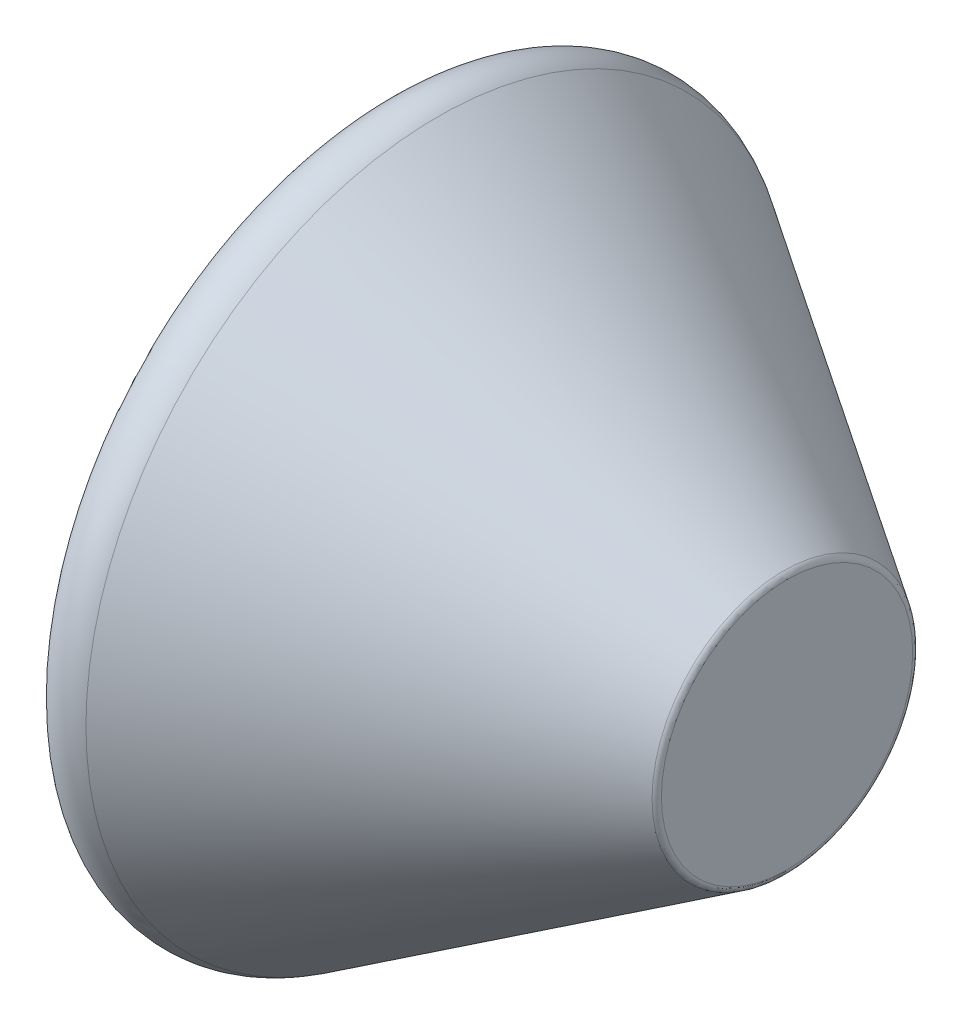
from build123d import *


with BuildPart() as part:
    # Sketch1 → Revolve1 (revolve)
    with BuildSketch(Plane.XY, mode=Mode.PRIVATE) as revolve1_sk:
        with BuildLine():
            Line((-710, 0), (2575, 0))
            Line((2575, 0), (2575, 878.535400948))
            ThreePointArc((2575, 878.535400948), (2568.836337785, 902.584839394), (2551.864980417, 920.704973239))
            Line((2551.864980417, 920.704973239), (134.324902087, 2460.847861453))
            ThreePointArc((134.324902087, 2460.847861453), (-73.907940114, 2488.825493589), (-229.939705353, 2348.121006428))
            ThreePointArc((-229.939705353, 2348.121006428), (-588.756386457, 1198.34575012), (-710, 0))
        make_face()
    revolve(revolve1_sk.sketch.rotate(Axis((2575, 0, 0), (1, 0, 0)), 90), axis=Axis((2575, 0, 0), (1, 0, 0)))


solid = part.part
